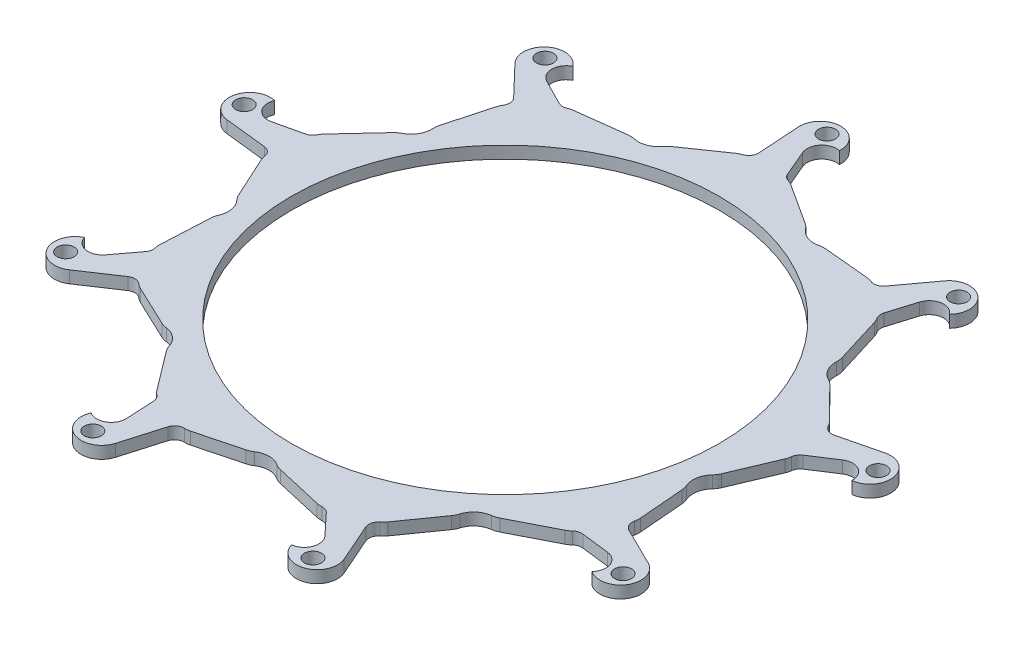
from build123d import *

# Parameters (mm, degrees)
SKETCH1_R           = 68.659375
SKETCH1_R_2         = 55.959375
BOSS_EXTRUDE1_DEPTH = 3.175
BOSS_EXTRUDE2_START = -3.175
BOSS_EXTRUDE2_DEPTH = 3.175
CIRPATTERN1_COUNT   = 9
SKETCH3_R           = 2.2225
CUT_EXTRUDE6_DEPTH  = 124.199501286
CIRPATTERN10_COUNT  = 9
CUT_EXTRUDE7_DEPTH  = 124.199501286
CIRPATTERN12_COUNT  = 9
FILLET1_R           = 5.08


with BuildPart() as part:
    # Sketch1 → Boss-Extrude1 (new body)
    with BuildSketch(Plane(origin=(0, 0, 0), x_dir=(1, 0, 0), z_dir=(0, 1, 0))):
        with Locations(Location((0, 0, 0), (0, 0, 270))):
            Circle(SKETCH1_R)
        with Locations(Location((0, 0, 0), (0, 0, 270))):
            Circle(SKETCH1_R_2, mode=Mode.SUBTRACT)
    extrude(amount=BOSS_EXTRUDE1_DEPTH)

    # Sketch2 → Boss-Extrude2 (add)
    with BuildSketch(Plane(origin=(0, 3.175, 0), x_dir=(1, 0, 0), z_dir=(0, 1, 0)).offset(BOSS_EXTRUDE2_START)):
        with BuildLine():
            Line((-4.653697789, 71.001707707), (-5.372788209, 81.972907412))
            ThreePointArc((-5.372788209, 81.972907412), (0, 87.709375), (5.372788209, 81.972907412))
            ThreePointArc((5.372788209, 81.972907412), (1.580107525, 80.725221164), (0.983574692, 76.777399446))
            Line((0.983574692, 76.777399446), (3.889375, 69.933810414))
            ThreePointArc((3.889375, 69.933810414), (4.734169071, 68.871766239), (6.005193091, 68.39625305))
            ThreePointArc((6.005193091, 68.39625305), (-0.46538454, 68.657797755), (-6.931822104, 68.308561818))
            ThreePointArc((-6.931822104, 68.308561818), (-5.249012804, 69.195180628), (-4.653697789, 71.001707707))
        make_face()
    boss_extrude2 = extrude(amount=BOSS_EXTRUDE2_DEPTH)

    # CirPattern1: Boss-Extrude2 ×9 about axis
    cirpattern1_axis = Axis((0, 0, 0), (0, 1, 0))
    for i in range(1, CIRPATTERN1_COUNT):
        add(boss_extrude2.rotate(cirpattern1_axis, i * 360 / CIRPATTERN1_COUNT))

    # Sketch3 → Cut-Extrude6 (cut, through all)
    with BuildSketch(Plane(origin=(0, 3.175, 0), x_dir=(1, 0, 0), z_dir=(0, 1, 0))):
        with Locations(Location((0, 84.132166, 0), (0, 0, 270))):
            Circle(SKETCH3_R)
    cut_extrude6 = extrude(amount=-CUT_EXTRUDE6_DEPTH, mode=Mode.SUBTRACT)

    # CirPattern10: Cut-Extrude6 ×9 about axis
    cirpattern10_axis = Axis((0, 0, 0), (0, 1, 0))
    for i in range(1, CIRPATTERN10_COUNT):
        add(cut_extrude6.rotate(cirpattern10_axis, i * 360 / CIRPATTERN10_COUNT), mode=Mode.SUBTRACT)

    # Sketch4 → Cut-Extrude7 (cut, through all)
    with BuildSketch(Plane(origin=(0, 3.175, 0), x_dir=(1, 0, 0), z_dir=(0, 1, 0))):
        with BuildLine():
            Line((18.267202623, 60.462203187), (6.005193091, 68.39625305))
            ThreePointArc((6.005193091, 68.39625305), (23.04503141, 64.676396797), (38.597813369, 56.78308356))
            Line((38.597813369, 56.78308356), (24.870866002, 58.05866628))
            ThreePointArc((24.870866002, 58.05866628), (21.122906044, 58.034707389), (18.267202623, 60.462203187))
        make_face()
    cut_extrude7 = extrude(amount=-CUT_EXTRUDE7_DEPTH, mode=Mode.SUBTRACT)

    # CirPattern12: Cut-Extrude7 ×9 about axis
    cirpattern12_axis = Axis((0, 0, 0), (0, 1, 0))
    for i in range(1, CIRPATTERN12_COUNT):
        add(cut_extrude7.rotate(cirpattern12_axis, i * 360 / CIRPATTERN12_COUNT), mode=Mode.SUBTRACT)

    # Fillet1
    fillet1_edges = [part.edges().sort_by_distance(p)[0] for p in [
        (-16.849122023, 1.5875, 66.559874267),
        (-62.235489211, 1.5875, 28.997476754),
        (-55.691038779, 1.5875, 40.157414946),
        (6.005193091, 1.5875, -68.39625305),
        (-66.314369444, 1.5875, -17.790845415),
        (-68.474499552, 1.5875, -5.035145128),
        (-6.931822104, 1.5875, -68.308561818),
        (-39.364019213, 1.5875, -56.254633292),
        (-49.217980976, 1.5875, -47.871704837),
        (24.870866002, 1.5875, -58.05866628),
        (18.267202623, 1.5875, -60.462203187),
        (56.371580016, 1.5875, -28.48883417),
        (52.857844124, 1.5875, -34.574803261),
        (61.49540524, 1.5875, 14.411240066),
        (62.715712909, 1.5875, 7.490531368),
        (37.844846907, 1.5875, 50.568134912),
        (43.228202617, 1.5875, 46.050963121),
        (-3.513735893, 1.5875, 63.063637431),
        (3.513735893, 1.5875, 63.063637431),
        (-43.228202617, 1.5875, 46.050963121),
        (-37.844846907, 1.5875, 50.568134912),
        (-62.715712909, 1.5875, 7.490531368),
        (-61.49540524, 1.5875, 14.411240066),
        (-52.857844124, 1.5875, -34.574803261),
        (-56.371580016, 1.5875, -28.48883417),
        (-18.267202623, 1.5875, -60.462203187),
        (-24.870866002, 1.5875, -58.05866628),
        (48.564508807, 1.5875, -48.534505867),
        (38.597813369, 1.5875, -56.78308356),
        (68.399951118, 1.5875, -5.962923987),
        (66.067103, 1.5875, -18.68816943),
        (56.23029612, 1.5875, 39.398776296),
        (62.622860883, 1.5875, 28.151146872),
        (17.749860638, 1.5875, 66.325351282),
        (29.876686184, 1.5875, 61.818228688),
        (-29.035931905, 1.5875, 62.217557279),
    ]]
    fillet(fillet1_edges, radius=FILLET1_R)


solid = part.part
